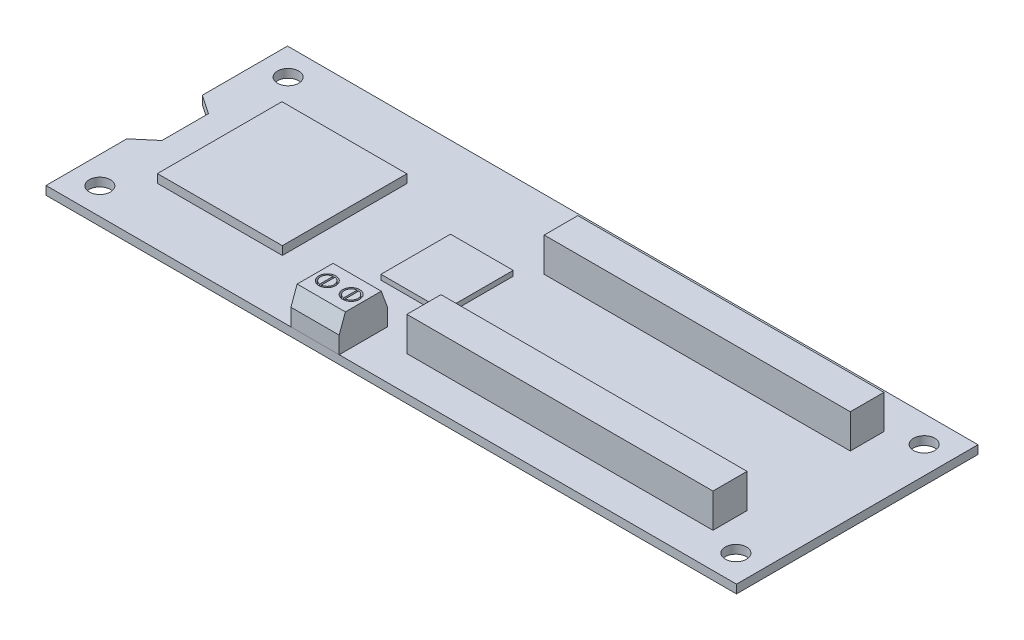
from build123d import *
from OCP.BRepFilletAPI import BRepFilletAPI_MakeChamfer

# Parameters (mm, degrees)
SKETCH1_W              = 103.124
SKETCH1_H              = 36.068
SKETCH1_R              = 1.5875
BOSS_EXTRUDE2_DEPTH    = 1.27
CUT_EXTRUDE1_DEPTH     = 55.639526901
SKETCH3_W              = 18.652856935
SKETCH3_H              = 18.593657226
BOSS_EXTRUDE3_DEPTH    = 1.27
SKETCH4_W              = 9.368625717
SKETCH4_H              = 10.379996134
BOSS_EXTRUDE4_DEPTH    = 0.762
SKETCH5_W              = 45.711956493
SKETCH5_H              = 5.024947681
SKETCH5_H_2            = 5.093258644
BOSS_EXTRUDE6_DEPTH    = 5.08
SKETCH6_W              = 7.204415031
SKETCH6_H              = 7.212704243
BOSS_EXTRUDE8_DEPTH    = 5.08
CHAMFER1_SIZE          = 2.54
CHAMFER1_SIZE2         = 0.924484395
SKETCH7_R              = 1.27
CUT_EXTRUDE2_DEPTH     = 0.762
BOSS_EXTRUDE10_DEPTH   = 0.762
BOSS_EXTRUDE10_2_DEPTH = 0.762
BOSS_EXTRUDE10_3_DEPTH = 0.762
BOSS_EXTRUDE10_4_DEPTH = 0.762


with BuildPart() as part:
    # Sketch1 → Boss-Extrude2 (new body)
    with BuildSketch(Plane(origin=(0, 0, 0), x_dir=(1, 0, 0), z_dir=(0, 1, 0))):
        Rectangle(SKETCH1_W, SKETCH1_H)
        with Locations(Location((-47.498, 14.0589, 0), (0, 0, 270))):
            Circle(SKETCH1_R, mode=Mode.SUBTRACT)
        with Locations(Location((-47.498, -14.0589, 0), (0, 0, 270))):
            Circle(SKETCH1_R, mode=Mode.SUBTRACT)
        with Locations(Location((47.498, 14.0589, 0), (0, 0, 270))):
            Circle(SKETCH1_R, mode=Mode.SUBTRACT)
        with Locations(Location((47.498, -14.0589, 0), (0, 0, 270))):
            Circle(SKETCH1_R, mode=Mode.SUBTRACT)
    extrude(amount=BOSS_EXTRUDE2_DEPTH)

    # Sketch2 → Cut-Extrude1 (cut, through all)
    with BuildSketch(Plane(origin=(0, 1.27, 0), x_dir=(1, 0, 0), z_dir=(0, 1, 0))):
        Polygon((-51.562, 5.32151794), (-48.722589703, 3.389029994), (-48.722589703, -3.55748073), (-51.562, -5.960033311), align=None)
    extrude(amount=-CUT_EXTRUDE1_DEPTH, mode=Mode.SUBTRACT)

    # Sketch3 → Boss-Extrude3 (add)
    with BuildSketch(Plane(origin=(0, 1.27, 0), x_dir=(1, 0, 0), z_dir=(0, 1, 0))):
        with Locations((-34.186132532, -0.144079079)):
            Rectangle(SKETCH3_W, SKETCH3_H)
    extrude(amount=BOSS_EXTRUDE3_DEPTH)

    # Sketch4 → Boss-Extrude4 (add)
    with BuildSketch(Plane(origin=(0, 1.27, 0), x_dir=(1, 0, 0), z_dir=(0, 1, 0))):
        with Locations((-9.617295377, -0.075408878)):
            Rectangle(SKETCH4_W, SKETCH4_H)
    extrude(amount=BOSS_EXTRUDE4_DEPTH)

    # Sketch5 → Boss-Extrude6 (add)
    with BuildSketch(Plane(origin=(0, 1.27, 0), x_dir=(1, 0, 0), z_dir=(0, 1, 0))):
        with Locations((19.986043909, 10.19248885)):
            Rectangle(SKETCH5_W, SKETCH5_H)
        with Locations((19.986043909, -10.283017769)):
            Rectangle(SKETCH5_W, SKETCH5_H_2)
    extrude(amount=BOSS_EXTRUDE6_DEPTH)


with BuildPart() as body_2:
    # Sketch6 → Boss-Extrude8 (new body)
    with BuildSketch(Plane(origin=(0, 1.27, 0), x_dir=(1, 0, 0), z_dir=(0, 1, 0))):
        with Locations((-11.378263959, -14.427647879)):
            Rectangle(SKETCH6_W, SKETCH6_H)
    extrude(amount=BOSS_EXTRUDE8_DEPTH)

    # Chamfer1: one chamfer whose edges measure the first distance from different faces: ONE call of the kernel's chamfer builder (chamfer() names one face for all edges)
    chamfer1_edges_1 = [body_2.edges().sort_by_distance(p)[0] for p in [
        (-11.378263958, 6.35, 10.821295757),
    ]]
    chamfer1_side_1 = [body_2.faces().sort_by_distance(p)[0] for p in [
        (-11.378263958, 3.81, 10.821295757),
    ]]
    chamfer1_edges_2 = [body_2.edges().sort_by_distance(p)[0] for p in [
        (-11.378263958, 6.35, 18.034),
    ]]
    chamfer1_side_2 = [body_2.faces().sort_by_distance(p)[0] for p in [
        (-11.378263958, 3.81, 18.034),
    ]]
    chamfer1 = BRepFilletAPI_MakeChamfer(body_2.part.solid().wrapped)
    for e in chamfer1_edges_1:
        chamfer1.Add(CHAMFER1_SIZE, CHAMFER1_SIZE2, e.wrapped, chamfer1_side_1[0].wrapped)  # the first distance lies on this face
    for e in chamfer1_edges_2:
        chamfer1.Add(CHAMFER1_SIZE, CHAMFER1_SIZE2, e.wrapped, chamfer1_side_2[0].wrapped)  # the first distance lies on this face
    add(Compound.cast(chamfer1.Shape()), mode=Mode.REPLACE)

    # Sketch7 → Cut-Extrude2 (cut)
    with BuildSketch(Plane(origin=(0, 6.35, 0), x_dir=(1, 0, 0), z_dir=(0, 1, 0))):
        with Locations(Location((-13.159630139, -14.427647879, 0), (0, 0, 270))):
            Circle(SKETCH7_R)
        with Locations(Location((-9.596897778, -14.427647879, 0), (0, 0, 270))):
            Circle(SKETCH7_R)
    extrude(amount=-CUT_EXTRUDE2_DEPTH, mode=Mode.SUBTRACT)


with BuildPart() as body_3:
    # Sketch8 → Boss-Extrude10 (new body)
    with BuildSketch(Plane(origin=(0, 5.588, 0), x_dir=(1, 0, 0), z_dir=(0, 1, 0))):
        with BuildLine():
            Line((-13.286630139, -15.435679128), (-13.286630139, -13.419616629))
            ThreePointArc((-13.286630139, -13.419616629), (-14.175630139, -14.427647879), (-13.286630139, -15.435679128))
        make_face()
    extrude(amount=BOSS_EXTRUDE10_DEPTH)


with BuildPart() as body_4:
    # Sketch8 → Boss-Extrude10 2 (new body)
    with BuildSketch(Plane(origin=(0, 5.588, 0), x_dir=(1, 0, 0), z_dir=(0, 1, 0))):
        with BuildLine():
            ThreePointArc((-12.143630139, -14.427647879), (-12.397630139, -13.755627046), (-13.032630139, -13.419616629))
            Line((-13.032630139, -13.419616629), (-13.032630139, -15.435679128))
            ThreePointArc((-13.032630139, -15.435679128), (-12.397630139, -15.099668712), (-12.143630139, -14.427647879))
        make_face()
    extrude(amount=BOSS_EXTRUDE10_2_DEPTH)


with BuildPart() as body_5:
    # Sketch8 → Boss-Extrude10 3 (new body)
    with BuildSketch(Plane(origin=(0, 5.588, 0), x_dir=(1, 0, 0), z_dir=(0, 1, 0))):
        with BuildLine():
            ThreePointArc((-9.723897778, -13.419616629), (-10.612897778, -14.427647879), (-9.723897778, -15.435679128))
            Line((-9.723897778, -15.435679128), (-9.723897778, -13.419616629))
        make_face()
    extrude(amount=BOSS_EXTRUDE10_3_DEPTH)


with BuildPart() as body_6:
    # Sketch8 → Boss-Extrude10 4 (new body)
    with BuildSketch(Plane(origin=(0, 5.588, 0), x_dir=(1, 0, 0), z_dir=(0, 1, 0))):
        with BuildLine():
            Line((-9.469897778, -13.419616629), (-9.469897778, -15.435679128))
            ThreePointArc((-9.469897778, -15.435679128), (-8.834897778, -15.099668712), (-8.580897778, -14.427647879))
            ThreePointArc((-8.580897778, -14.427647879), (-8.834897778, -13.755627046), (-9.469897778, -13.419616629))
        make_face()
    extrude(amount=BOSS_EXTRUDE10_4_DEPTH)


solid = Compound([part.part, body_2.part, body_3.part, body_4.part, body_5.part, body_6.part])
